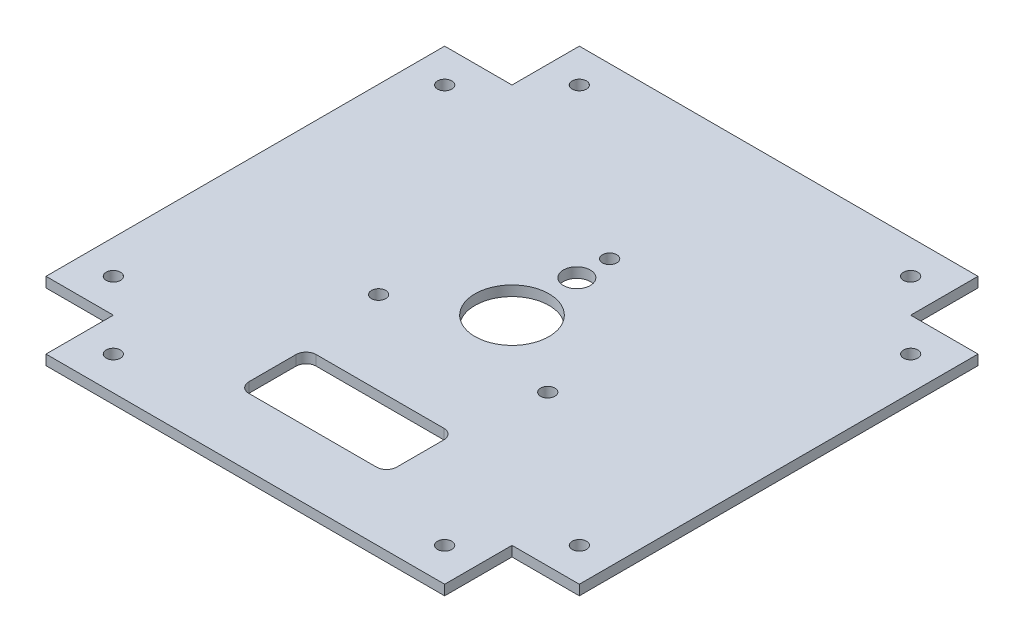
from build123d import *

# Parameters (mm, degrees)
SKETCH1_W           = 158.4
SKETCH1_H           = 158.4
BOSS_EXTRUDE1_DEPTH = 3
SKETCH2_R           = 2.125
SKETCH2_R_2         = 11
SKETCH2_R_3         = 4
SKETCH2_W           = 43.911972264
SKETCH2_H           = 20
CUT_EXTRUDE3_DEPTH  = 113.045883459
SKETCH3_W           = 20
SKETCH3_H           = 20
CUT_EXTRUDE4_DEPTH  = 113.045883459
FILLET1_R           = 3


with BuildPart() as part:
    # Sketch1 → Boss-Extrude1 (new body)
    with BuildSketch(Plane(origin=(0, 0, 0), x_dir=(1, 0, 0), z_dir=(0, 1, 0))):
        Rectangle(SKETCH1_W, SKETCH1_H)
    extrude(amount=BOSS_EXTRUDE1_DEPTH)

    # Sketch2 → Cut-Extrude3 (cut, through all)
    with BuildSketch(Plane(origin=(0, 3, 0), x_dir=(1, 0, 0), z_dir=(0, 1, 0))):
        with Locations(Location((-69.2, -49.2, 0), (0, 0, 270))):
            Circle(SKETCH2_R)
        with Locations(Location((-69.2, 49.2, 0), (0, 0, 90))):
            Circle(SKETCH2_R)
        with Locations(Location((-49.2, 69.2, 0), (0, 0, 270))):
            Circle(SKETCH2_R)
        with Locations(Location((49.2, 69.2, 0), (0, 0, 90))):
            Circle(SKETCH2_R)
        with Locations(Location((69.2, 49.2, 0), (0, 0, 270))):
            Circle(SKETCH2_R)
        with Locations(Location((69.2, -49.2, 0), (0, 0, 90))):
            Circle(SKETCH2_R)
        with Locations(Location((49.2, -69.2, 0), (0, 0, 270))):
            Circle(SKETCH2_R)
        with Locations(Location((-49.2, -69.2, 0), (0, 0, 90))):
            Circle(SKETCH2_R)
        with Locations(Location((0, 0, 0), (0, 0, 270))):
            Circle(SKETCH2_R_2)
        with Locations(Location((0, 29, 0), (0, 0, 270))):
            Circle(SKETCH2_R)
        with Locations(Location((25.11473671, -14.5, 0), (0, 0, 270))):
            Circle(SKETCH2_R)
        with Locations(Location((-25.11473671, -14.5, 0), (0, 0, 270))):
            Circle(SKETCH2_R)
        with Locations(Location((0, 19.25, 0), (0, 0, 270))):
            Circle(SKETCH2_R_3)
        with Locations((0, -49.2)):
            Rectangle(SKETCH2_W, SKETCH2_H)
    extrude(amount=-CUT_EXTRUDE3_DEPTH, mode=Mode.SUBTRACT)

    # Sketch3 → Cut-Extrude4 (cut, through all)
    with BuildSketch(Plane(origin=(0, 3, 0), x_dir=(1, 0, 0), z_dir=(0, 1, 0))):
        with Locations((69.2, 69.2)):
            Rectangle(SKETCH3_W, SKETCH3_H)
        with Locations((-69.2, 69.2)):
            Rectangle(SKETCH3_W, SKETCH3_H)
        with Locations((69.2, -69.2)):
            Rectangle(SKETCH3_W, SKETCH3_H)
        with Locations((-69.2, -69.2)):
            Rectangle(SKETCH3_W, SKETCH3_H)
    extrude(amount=-CUT_EXTRUDE4_DEPTH, mode=Mode.SUBTRACT)

    # Fillet1
    fillet1_edges = [part.edges().sort_by_distance(p)[0] for p in [
        (21.955986132, 1.5, 39.2),
        (21.955986132, 1.5, 59.2),
        (-21.955986132, 1.5, 59.2),
        (-21.955986132, 1.5, 39.2),
    ]]
    fillet(fillet1_edges, radius=FILLET1_R)


solid = part.part
